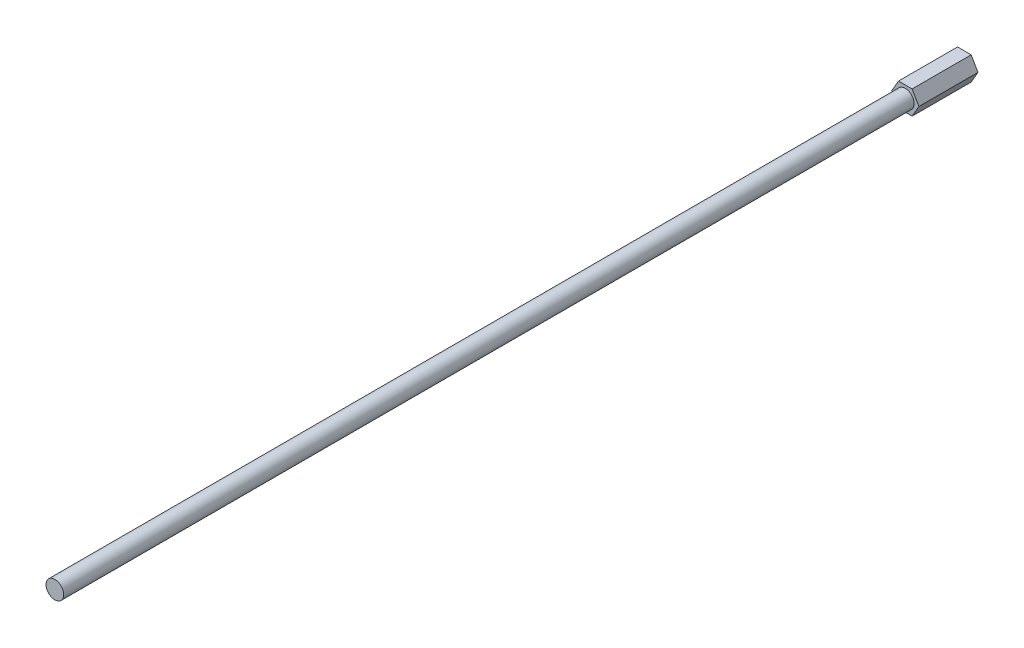
from build123d import *

# Parameters (mm, degrees)
BOSS_EXTRUDE1_DEPTH = 31.75
SKETCH2_R           = 4.7625
BOSS_EXTRUDE2_DEPTH = 457.2


with BuildPart() as part:
    # Sketch1 → Boss-Extrude1 (new body)
    with BuildSketch(Plane.XY):
        Polygon((7.332348419, 0), (3.666174209, 6.35), (-3.666174209, 6.35), (-7.332348419, 0), (-3.666174209, -6.35), (3.666174209, -6.35), align=None)
    extrude(amount=BOSS_EXTRUDE1_DEPTH)

    # Sketch2 → Boss-Extrude2 (add)
    with BuildSketch(Plane.XY.offset(31.75)):
        Circle(SKETCH2_R)
    extrude(amount=BOSS_EXTRUDE2_DEPTH)


solid = part.part
